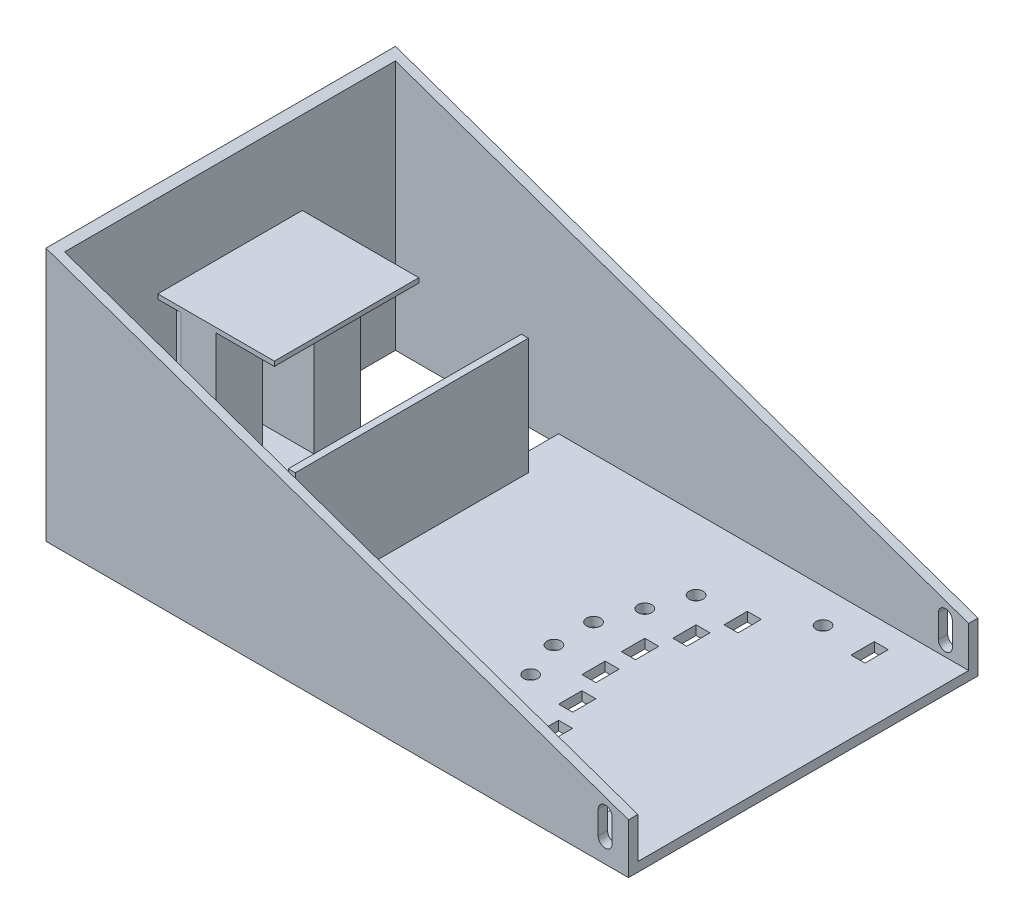
from build123d import *

# Parameters (mm, degrees)
SKETCH1_W            = 200
SKETCH1_H            = 150
SKETCH1_W_2          = 192
SKETCH1_H_2          = 142
BOSS_EXTRUDE2_DEPTH  = 4
SKETCH2_W            = 200
SKETCH2_H            = 150
SKETCH2_W_2          = 192
SKETCH2_H_2          = 142
BOSS_EXTRUDE3_DEPTH  = 80
CUT_EXTRUDE1_DEPTH   = 150
SKETCH4_R            = 3
SKETCH4_W            = 6
SKETCH4_H            = 10
CUT_EXTRUDE2_DEPTH   = 10
SKETCH5_W            = 142
SKETCH5_H            = 11.4
CUT_EXTRUDE4_DEPTH   = 10
SKETCH6_W            = 25
SKETCH6_H            = 20
BOSS_EXTRUDE4_DEPTH  = 66
SKETCH7_W            = 5
SKETCH7_H            = 37.5
CUT_EXTRUDE5_DEPTH   = 66
BOSS_EXTRUDE6_DEPTH  = 4
BOSS_EXTRUDE7_DEPTH  = 4
BOSS_EXTRUDE8_DEPTH  = 142
FILLET1_R            = 5
FILLET2_R            = 5
FILLET3_R            = 5
SKETCH15_W           = 62
SKETCH15_H           = 2
BOSS_EXTRUDE9_DEPTH  = 50
SKETCH16_W           = 6
SKETCH16_H           = 20
CUT_EXTRUDE8_DEPTH   = 50
SKETCH17_W           = 7
SKETCH17_H           = 10
CUT_EXTRUDE9_DEPTH   = 50
SKETCH18_W           = 50
SKETCH18_H           = 150
BOSS_EXTRUDE10_DEPTH = 4
SKETCH19_W           = 50
SKETCH19_H           = 4
BOSS_EXTRUDE11_DEPTH = 35
CUT_EXTRUDE10_DEPTH  = 210
SKETCH21_R           = 3
SKETCH21_W           = 6
SKETCH21_H           = 10
CUT_EXTRUDE11_DEPTH  = 30
SKETCH22_W           = 3
SKETCH22_H           = 100
BOSS_EXTRUDE12_DEPTH = 50
CUT_EXTRUDE12_DEPTH  = 150


with BuildPart() as part:
    # Sketch1 → Boss-Extrude2 (new body)
    # profile 1 of 3: a face of its own
    with BuildSketch(Plane(origin=(0, 0, 0), x_dir=(1, 0, 0), z_dir=(0, 1, 0))):
        with Locations((-100, 75)):
            Rectangle(SKETCH1_W, SKETCH1_H)
        with Locations((-100, 75)):
            Rectangle(SKETCH1_W_2, SKETCH1_H_2, mode=Mode.SUBTRACT)
    # profile 2 of 3: a face of its own
    with BuildSketch(Plane(origin=(0, 0, 0), x_dir=(1, 0, 0), z_dir=(0, 1, 0))):
        Polygon((-4, 75), (-196, 75), (-196, 44), (-171, 44), (-171, 64), (-163, 64), (-163, 74), (-159, 74), (-159, 64), (-151, 64), (-151, 44), (-126, 44), (-126, 4), (-4, 4), align=None)
    # profile 3 of 3: a face of its own
    with BuildSketch(Plane(origin=(0, 0, 0), x_dir=(1, 0, 0), z_dir=(0, 1, 0))):
        Polygon((-196, 106), (-196, 75), (-4, 75), (-4, 146), (-126, 146), (-126, 106), (-151, 106), (-151, 86), (-159, 86), (-159, 76), (-163, 76), (-163, 86), (-171, 86), (-171, 106), align=None)
    extrude(amount=BOSS_EXTRUDE2_DEPTH)

    # Sketch2 → Boss-Extrude3 (add)
    with BuildSketch(Plane(origin=(0, 4, 0), x_dir=(1, 0, 0), z_dir=(0, 1, 0))):
        with Locations((-100, 75)):
            Rectangle(SKETCH2_W, SKETCH2_H)
        with Locations((-100, 75)):
            Rectangle(SKETCH2_W_2, SKETCH2_H_2, mode=Mode.SUBTRACT)
    extrude(amount=BOSS_EXTRUDE3_DEPTH)

    # Sketch3 → Cut-Extrude1 (cut)
    with BuildSketch(Plane.XY):
        Polygon((-200, 84), (0, 14), (0, 84), align=None)
    extrude(amount=-CUT_EXTRUDE1_DEPTH, mode=Mode.SUBTRACT)

    # Sketch4 → Cut-Extrude2 (cut)
    with BuildSketch(Plane(origin=(0, 4, 0), x_dir=(1, 0, 0), z_dir=(0, 1, 0))):
        with Locations(Location((-36.5, 115.5, 0), (0, 0, 270))):
            Circle(SKETCH4_R)
        with Locations(Location((-42.5, 99.5, 0), (0, 0, 270))):
            Circle(SKETCH4_R)
        with Locations(Location((-48.5, 83.5, 0), (0, 0, 270))):
            Circle(SKETCH4_R)
        with Locations(Location((-48.5, 66.5, 0), (0, 0, 270))):
            Circle(SKETCH4_R)
        with Locations(Location((-42.5, 50.5, 0), (0, 0, 270))):
            Circle(SKETCH4_R)
        with Locations(Location((-36.5, 34.5, 0), (0, 0, 270))):
            Circle(SKETCH4_R)
        with Locations((-16.5, 34.5)):
            Rectangle(SKETCH4_W, SKETCH4_H)
        with Locations((-16.5, 115.5)):
            Rectangle(SKETCH4_W, SKETCH4_H)
        with Locations((-22.5, 99.5)):
            Rectangle(SKETCH4_W, SKETCH4_H)
        with Locations((-22.5, 50.5)):
            Rectangle(SKETCH4_W, SKETCH4_H)
        with Locations((-28.5, 66.5)):
            Rectangle(SKETCH4_W, SKETCH4_H)
        with Locations((-28.5, 83.5)):
            Rectangle(SKETCH4_W, SKETCH4_H)
    extrude(amount=-CUT_EXTRUDE2_DEPTH, mode=Mode.SUBTRACT)

    # Sketch5 → Cut-Extrude4 (cut)
    with BuildSketch(Plane(origin=(0, 0, 0), x_dir=(0, 0, -1), z_dir=(1, 0, 0))):
        with Locations((75, 9.7)):
            Rectangle(SKETCH5_W, SKETCH5_H)
    extrude(amount=-CUT_EXTRUDE4_DEPTH, mode=Mode.SUBTRACT)

    # Sketch6 → Boss-Extrude4 (add)
    with BuildSketch(Plane(origin=(0, 4, 0), x_dir=(1, 0, 0), z_dir=(0, 1, 0))):
        with Locations((-183.5, 54)):
            Rectangle(SKETCH6_W, SKETCH6_H)
        with Locations((-183.5, 96)):
            Rectangle(SKETCH6_W, SKETCH6_H)
    extrude(amount=BOSS_EXTRUDE4_DEPTH)

    # Sketch7 → Cut-Extrude5 (cut)
    with BuildSketch(Plane(origin=(0, 0, -106), x_dir=(-1, 0, 0), z_dir=(0, 0, -1))):
        with Locations((193.5, 51.25)):
            Rectangle(SKETCH7_W, SKETCH7_H)
    extrude(amount=-CUT_EXTRUDE5_DEPTH, mode=Mode.SUBTRACT)

    # Sketch12 → Boss-Extrude6 (add)
    with BuildSketch(Plane.XY):
        Polygon((-200, 84), (-200, 109), (0, 39), (0, 14), align=None)
    extrude(amount=-BOSS_EXTRUDE6_DEPTH)

    # Sketch13 → Boss-Extrude7 (add)
    with BuildSketch(Plane(origin=(0, 0, -150), x_dir=(-1, 0, 0), z_dir=(0, 0, -1))):
        Polygon((0, 14), (0, 39), (200, 109), (200, 84), align=None)
    extrude(amount=-BOSS_EXTRUDE7_DEPTH)

    # Sketch14 → Boss-Extrude8 (add)
    with BuildSketch(Plane.XY.offset(-146)):
        Polygon((-200, 84), (-200, 109), (-196, 107.6), (-196, 82.6), align=None)
    extrude(amount=BOSS_EXTRUDE8_DEPTH)

    # Fillet1
    fillet1_edges = [part.edges().sort_by_distance(p)[0] for p in [
        (-191, 51.25, -106),
    ]]
    fillet(fillet1_edges, radius=FILLET1_R)

    # Fillet2
    fillet2_edges = [part.edges().sort_by_distance(p)[0] for p in [
        (-191, 51.25, -86),
    ]]
    fillet(fillet2_edges, radius=FILLET2_R)

    # Fillet3
    fillet3_edges = [part.edges().sort_by_distance(p)[0] for p in [
        (-191, 51.25, -44),
        (-191, 51.25, -64),
    ]]
    fillet(fillet3_edges, radius=FILLET3_R)

    # Sketch15 → Boss-Extrude9 (add)
    with BuildSketch(Plane(origin=(-196, 0, 0), x_dir=(0, 0, -1), z_dir=(1, 0, 0))):
        with Locations((75, 71)):
            Rectangle(SKETCH15_W, SKETCH15_H)
    extrude(amount=BOSS_EXTRUDE9_DEPTH)

    # Sketch16 → Cut-Extrude8 (cut)
    with BuildSketch(Plane(origin=(0, 4, 0), x_dir=(1, 0, 0), z_dir=(0, 1, 0))):
        with Locations((-148, 96)):
            Rectangle(SKETCH16_W, SKETCH16_H)
        with Locations((-148, 54)):
            Rectangle(SKETCH16_W, SKETCH16_H)
    extrude(amount=-CUT_EXTRUDE8_DEPTH, mode=Mode.SUBTRACT)

    # Sketch17 → Cut-Extrude9 (cut)
    with BuildSketch(Plane(origin=(0, 4, 0), x_dir=(1, 0, 0), z_dir=(0, 1, 0))):
        with Locations((-161, 69)):
            Rectangle(SKETCH17_W, SKETCH17_H)
        with Locations((-161, 81)):
            Rectangle(SKETCH17_W, SKETCH17_H)
    extrude(amount=-CUT_EXTRUDE9_DEPTH, mode=Mode.SUBTRACT)

    # Sketch18 → Boss-Extrude10 (add)
    with BuildSketch(Plane.XZ):
        with Locations((25, -75)):
            Rectangle(SKETCH18_W, SKETCH18_H)
    extrude(amount=-BOSS_EXTRUDE10_DEPTH)

    # Sketch19 → Boss-Extrude11 (add)
    with BuildSketch(Plane(origin=(0, 4, 0), x_dir=(1, 0, 0), z_dir=(0, 1, 0))):
        with Locations((25, 148)):
            Rectangle(SKETCH19_W, SKETCH19_H)
        with Locations((25, 2)):
            Rectangle(SKETCH19_W, SKETCH19_H)
    extrude(amount=BOSS_EXTRUDE11_DEPTH)

    # Sketch20 → Cut-Extrude10 (cut)
    with BuildSketch(Plane.XY):
        Polygon((0, 39), (50, 21.5), (50, 39), align=None)
    extrude(amount=-CUT_EXTRUDE10_DEPTH, mode=Mode.SUBTRACT)

    # Sketch21 → Cut-Extrude11 (cut)
    with BuildSketch(Plane(origin=(0, 4, 0), x_dir=(1, 0, 0), z_dir=(0, 1, 0))):
        with Locations(Location((2, 131.5, 0), (0, 0, 270))):
            Circle(SKETCH21_R)
        with Locations(Location((2, 18.5, 0), (0, 0, 270))):
            Circle(SKETCH21_R)
        with Locations((22, 18.5)):
            Rectangle(SKETCH21_W, SKETCH21_H)
        with Locations((22, 131.5)):
            Rectangle(SKETCH21_W, SKETCH21_H)
    extrude(amount=-CUT_EXTRUDE11_DEPTH, mode=Mode.SUBTRACT)

    # Sketch22 → Boss-Extrude12 (add)
    with BuildSketch(Plane(origin=(0, 4, 0), x_dir=(1, 0, 0), z_dir=(0, 1, 0))):
        with Locations((-119.5, 75)):
            Rectangle(SKETCH22_W, SKETCH22_H)
    extrude(amount=BOSS_EXTRUDE12_DEPTH)

    # Sketch23 → Cut-Extrude12 (cut)
    with BuildSketch(Plane(origin=(0, 0, -150), x_dir=(-1, 0, 0), z_dir=(0, 0, -1))):
        with BuildLine():
            Line((-43, 9), (-43, 19))
            ThreePointArc((-43, 19), (-40, 22), (-37, 19))
            Line((-37, 19), (-37, 9))
            ThreePointArc((-37, 9), (-40, 6), (-43, 9))
        make_face()
    extrude(amount=-CUT_EXTRUDE12_DEPTH, mode=Mode.SUBTRACT)


solid = part.part
